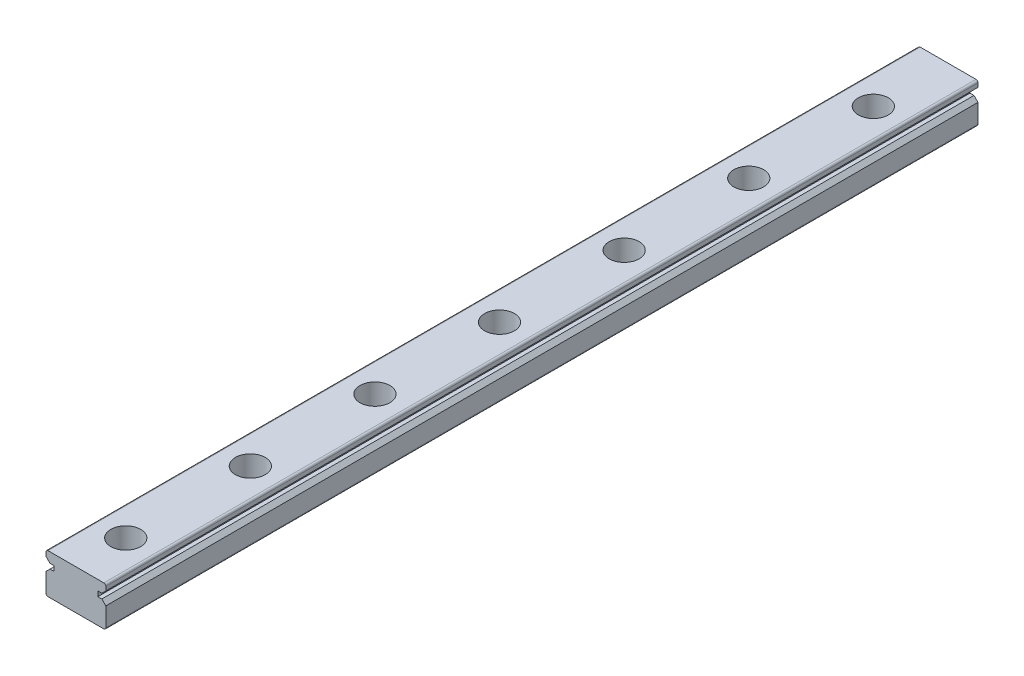
from build123d import *

# Parameters (mm, degrees)
BOSS_EXTRUDE1_DEPTH = 300
SKETCH2_R           = 3
CUT_EXTRUDE1_DEPTH  = 4.5
SKETCH3_R           = 1.75
CUT_EXTRUDE2_DEPTH  = 301.166620396
CUT_EXTRUDE3_DEPTH  = 3
SKETCH5_W           = 12
SKETCH5_H           = 125
CUT_EXTRUDE5_DEPTH  = 301.101649446


with BuildPart() as part:
    # Sketch1 → Boss-Extrude1 (new body)
    with BuildSketch(Plane.XY):
        with BuildLine():
            Line((-5.6, 4), (5.6, 4))
            ThreePointArc((5.6, 4), (5.882842712, 3.882842712), (6, 3.6))
            Line((6, 3.6), (6, 2.8))
            Line((6, 2.8), (5.2, 2))
            Line((5.2, 2), (4.4, 2))
            Line((4.4, 2), (4.4, 1))
            Line((4.4, 1), (5.2, 1))
            Line((5.2, 1), (6, 0.2))
            Line((6, 0.2), (6, -3.6))
            ThreePointArc((6, -3.6), (5.882842712, -3.882842712), (5.6, -4))
            Line((5.6, -4), (-5.6, -4))
            ThreePointArc((-5.6, -4), (-5.882842712, -3.882842712), (-6, -3.6))
            Line((-6, -3.6), (-6, 0.2))
            Line((-6, 0.2), (-5.2, 1))
            Line((-5.2, 1), (-4.4, 1))
            Line((-4.4, 1), (-4.4, 2))
            Line((-4.4, 2), (-5.2, 2))
            Line((-5.2, 2), (-6, 2.8))
            Line((-6, 2.8), (-6, 3.6))
            ThreePointArc((-6, 3.6), (-5.882842712, 3.882842712), (-5.6, 4))
        make_face()
    extrude(amount=BOSS_EXTRUDE1_DEPTH)

    # Sketch2 → Cut-Extrude1 (cut)
    with BuildSketch(Plane(origin=(0, 4, 0), x_dir=(1, 0, 0), z_dir=(0, 1, 0))):
        with Locations(Location((0, -290, 0), (0, 0, 270))):
            Circle(SKETCH2_R)
        with Locations(Location((0, -265, 0), (0, 0, 270))):
            Circle(SKETCH2_R)
        with Locations(Location((0, -240, 0), (0, 0, 270))):
            Circle(SKETCH2_R)
        with Locations(Location((0, -215, 0), (0, 0, 270))):
            Circle(SKETCH2_R)
        with Locations(Location((0, -190, 0), (0, 0, 270))):
            Circle(SKETCH2_R)
        with Locations(Location((0, -165, 0), (0, 0, 270))):
            Circle(SKETCH2_R)
        with Locations(Location((0, -140, 0), (0, 0, 270))):
            Circle(SKETCH2_R)
        with Locations(Location((0, -115, 0), (0, 0, 270))):
            Circle(SKETCH2_R)
        with Locations(Location((0, -90, 0), (0, 0, 270))):
            Circle(SKETCH2_R)
        with Locations(Location((0, -65, 0), (0, 0, 270))):
            Circle(SKETCH2_R)
        with Locations(Location((0, -40, 0), (0, 0, 270))):
            Circle(SKETCH2_R)
        with Locations(Location((0, -15, 0), (0, 0, 270))):
            Circle(SKETCH2_R)
        with Locations((0, 10)):
            Circle(SKETCH2_R)
        with Locations((0, 35)):
            Circle(SKETCH2_R)
        with Locations((0, 60)):
            Circle(SKETCH2_R)
        with Locations((0, 85)):
            Circle(SKETCH2_R)
        with Locations((0, 110)):
            Circle(SKETCH2_R)
        with Locations((0, 135)):
            Circle(SKETCH2_R)
    extrude(amount=-CUT_EXTRUDE1_DEPTH, mode=Mode.SUBTRACT)

    # Sketch3 → Cut-Extrude2 (cut, through all)
    with BuildSketch(Plane(origin=(0, 4, 0), x_dir=(1, 0, 0), z_dir=(0, 1, 0))):
        with Locations(Location((0, -290.001504258, 0), (0, 0, 270))):
            Circle(SKETCH3_R)
        with Locations(Location((0, -265.001504258, 0), (0, 0, 270))):
            Circle(SKETCH3_R)
        with Locations(Location((0, -240.001504258, 0), (0, 0, 270))):
            Circle(SKETCH3_R)
        with Locations(Location((0, -215.001504258, 0), (0, 0, 270))):
            Circle(SKETCH3_R)
        with Locations(Location((0, -190.001504258, 0), (0, 0, 270))):
            Circle(SKETCH3_R)
        with Locations(Location((0, -165.001504258, 0), (0, 0, 270))):
            Circle(SKETCH3_R)
        with Locations(Location((0, -140.001504258, 0), (0, 0, 270))):
            Circle(SKETCH3_R)
        with Locations(Location((0, -115.001504258, 0), (0, 0, 270))):
            Circle(SKETCH3_R)
        with Locations(Location((0, -90.001504258, 0), (0, 0, 270))):
            Circle(SKETCH3_R)
        with Locations(Location((0, -65.001504258, 0), (0, 0, 270))):
            Circle(SKETCH3_R)
        with Locations(Location((0, -40.001504258, 0), (0, 0, 270))):
            Circle(SKETCH3_R)
        with Locations(Location((0, -15.001504258, 0), (0, 0, 270))):
            Circle(SKETCH3_R)
        with Locations((0, 9.998495742)):
            Circle(SKETCH3_R)
        with Locations((0, 34.998495742)):
            Circle(SKETCH3_R)
        with Locations((0, 59.998495742)):
            Circle(SKETCH3_R)
    extrude(amount=-CUT_EXTRUDE2_DEPTH, mode=Mode.SUBTRACT)

    # Sketch4 → Cut-Extrude3 (cut)
    with BuildSketch(Plane.XZ.offset(4)):
        Polygon((-6, 125), (-2, 125), (-2, 127), (-4, 127), (0, 133), (4, 127), (2, 127), (2, 125), (6, 125), (29.677261244, -70.087794046), (-63.472645217, -88.905956967), align=None)
    extrude(amount=-CUT_EXTRUDE3_DEPTH, mode=Mode.SUBTRACT)

    # Sketch5 → Cut-Extrude5 (cut, through all)
    with BuildSketch(Plane.XZ.offset(1)):
        with Locations((0, 62.5)):
            Rectangle(SKETCH5_W, SKETCH5_H)
    extrude(amount=-CUT_EXTRUDE5_DEPTH, mode=Mode.SUBTRACT)


solid = part.part
